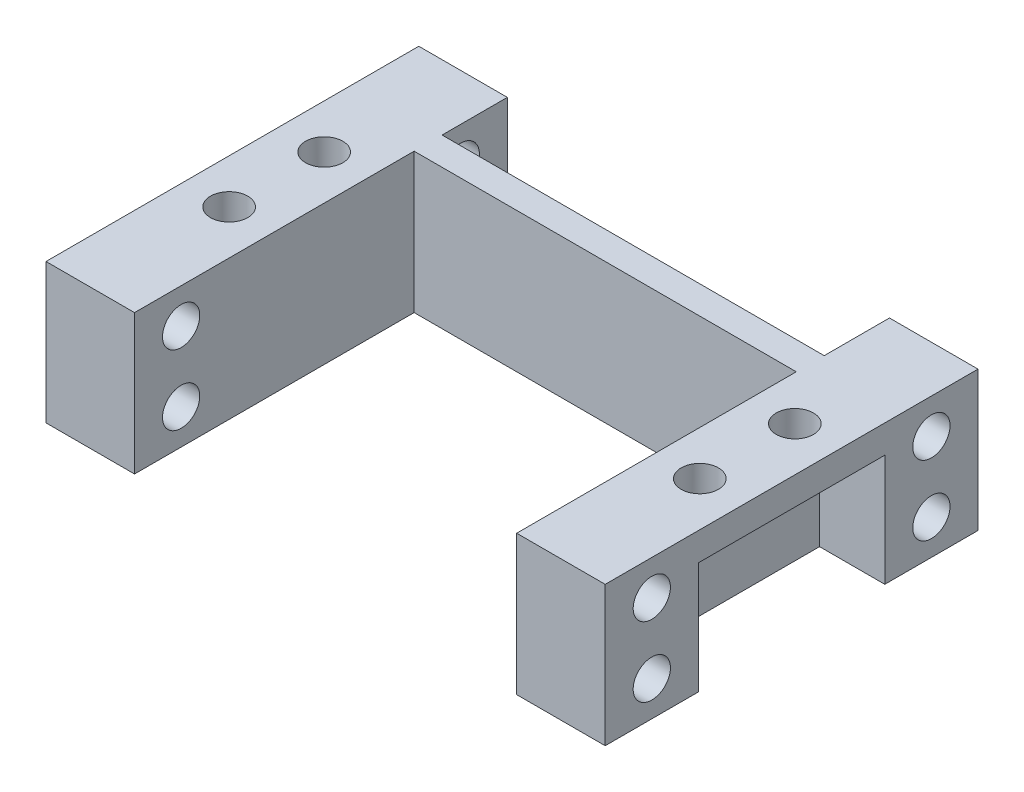
from build123d import *

# Parameters (mm, degrees)
SKETCH1_W               = 46
SKETCH1_H               = 15
BOSS_EXTRUDE1_DEPTH     = 3
SKETCH3_W               = 2.5
SKETCH3_H               = 15
BOSS_EXTRUDE2_DEPTH     = 20
SKETCH4_W               = 20
SKETCH4_H               = 3
BOSS_EXTRUDE3_DEPTH     = 7
SKETCH5_R               = 2
CUT_EXTRUDE1_DEPTH      = 7
SKETCH7_W               = 9.5
SKETCH7_H               = 15
BOSS_EXTRUDE4_DEPTH     = 10
SKETCH8_R               = 2
CUT_EXTRUDE2_DEPTH      = 10
MIRROR3_COPY_1_SKETCH_W = 9.5
MIRROR3_COPY_1_SKETCH_H = 15
MIRROR3_COPY_1_DEPTH    = 10
MIRROR3_COPY_2_SKETCH_R = 2
MIRROR3_COPY_2_DEPTH    = 10


with BuildPart() as part:
    # Sketch1 → Boss-Extrude1 (new body)
    with BuildSketch(Plane.XY):
        with Locations((23, 7.5)):
            Rectangle(SKETCH1_W, SKETCH1_H)
    extrude(amount=BOSS_EXTRUDE1_DEPTH)

    # Sketch3 → Boss-Extrude2 (add)
    with BuildSketch(Plane.XY.offset(3)):
        with Locations((1.25, 7.5)):
            Rectangle(SKETCH3_W, SKETCH3_H)
    boss_extrude2 = extrude(amount=BOSS_EXTRUDE2_DEPTH)

    # Sketch4 → Boss-Extrude3 (add)
    with BuildSketch(Plane.ZY):
        with Locations((13, 13.5)):
            Rectangle(SKETCH4_W, SKETCH4_H)
    boss_extrude3 = extrude(amount=BOSS_EXTRUDE3_DEPTH)

    # Sketch5 → Cut-Extrude1 (cut)
    with BuildSketch(Plane(origin=(0, 15, 0), x_dir=(1, 0, 0), z_dir=(0, 1, 0))):
        with Locations(Location((-2.25, -18.1, 0), (0, 0, 270))):
            Circle(SKETCH5_R)
        with Locations(Location((-2.25, -7.9, 0), (0, 0, 270))):
            Circle(SKETCH5_R)
    cut_extrude1 = extrude(amount=-CUT_EXTRUDE1_DEPTH, mode=Mode.SUBTRACT)

    # Mirror1: Boss-Extrude2, Boss-Extrude3, Cut-Extrude1 across plane
    add(boss_extrude2.mirror(Plane(origin=(23, 0, 0), x_dir=(0, 0, 1), z_dir=(1, 0, 0))))
    add(boss_extrude3.mirror(Plane(origin=(23, 0, 0), x_dir=(0, 0, 1), z_dir=(1, 0, 0))))
    add(cut_extrude1.mirror(Plane(origin=(23, 0, 0), x_dir=(0, 0, 1), z_dir=(1, 0, 0))), mode=Mode.SUBTRACT)

    # Sketch7 → Boss-Extrude4 (add)
    with BuildSketch(Plane.XY.offset(23)):
        with Locations((-2.25, 7.5)):
            Rectangle(SKETCH7_W, SKETCH7_H)
    boss_extrude4 = extrude(amount=BOSS_EXTRUDE4_DEPTH)

    # Sketch8 → Cut-Extrude2 (cut)
    with BuildSketch(Plane.ZY.offset(7)):
        with Locations((28, 11.25)):
            Circle(SKETCH8_R)
        with Locations((28, 3.75)):
            Circle(SKETCH8_R)
    cut_extrude2 = extrude(amount=-CUT_EXTRUDE2_DEPTH, mode=Mode.SUBTRACT)

    # Mirror2: Boss-Extrude4, Cut-Extrude2 across plane
    add(boss_extrude4.mirror(Plane(origin=(23, 0, 0), x_dir=(0, 0, 1), z_dir=(1, 0, 0))))
    add(cut_extrude2.mirror(Plane(origin=(23, 0, 0), x_dir=(0, 0, 1), z_dir=(1, 0, 0))), mode=Mode.SUBTRACT)

    # Mirror3: Boss-Extrude4, Cut-Extrude2 across plane
    add(boss_extrude4.mirror(Plane.XY.offset(13)))
    add(cut_extrude2.mirror(Plane.XY.offset(13)), mode=Mode.SUBTRACT)

    # Mirror3 copy 1 sketch → Mirror3 copy 1 (add)
    with BuildSketch(Plane(origin=(46, 0, 3), x_dir=(-1, 0, 0), z_dir=(0, 0, -1))):
        with Locations((-2.25, 7.5)):
            Rectangle(MIRROR3_COPY_1_SKETCH_W, MIRROR3_COPY_1_SKETCH_H)
    extrude(amount=MIRROR3_COPY_1_DEPTH)

    # Mirror3 copy 2 sketch → Mirror3 copy 2 (cut)
    with BuildSketch(Plane(origin=(53, 0, 26), x_dir=(0, 0, -1), z_dir=(1, 0, 0))):
        with Locations((28, 11.25)):
            Circle(MIRROR3_COPY_2_SKETCH_R)
        with Locations((28, 3.75)):
            Circle(MIRROR3_COPY_2_SKETCH_R)
    extrude(amount=-MIRROR3_COPY_2_DEPTH, mode=Mode.SUBTRACT)


solid = part.part
